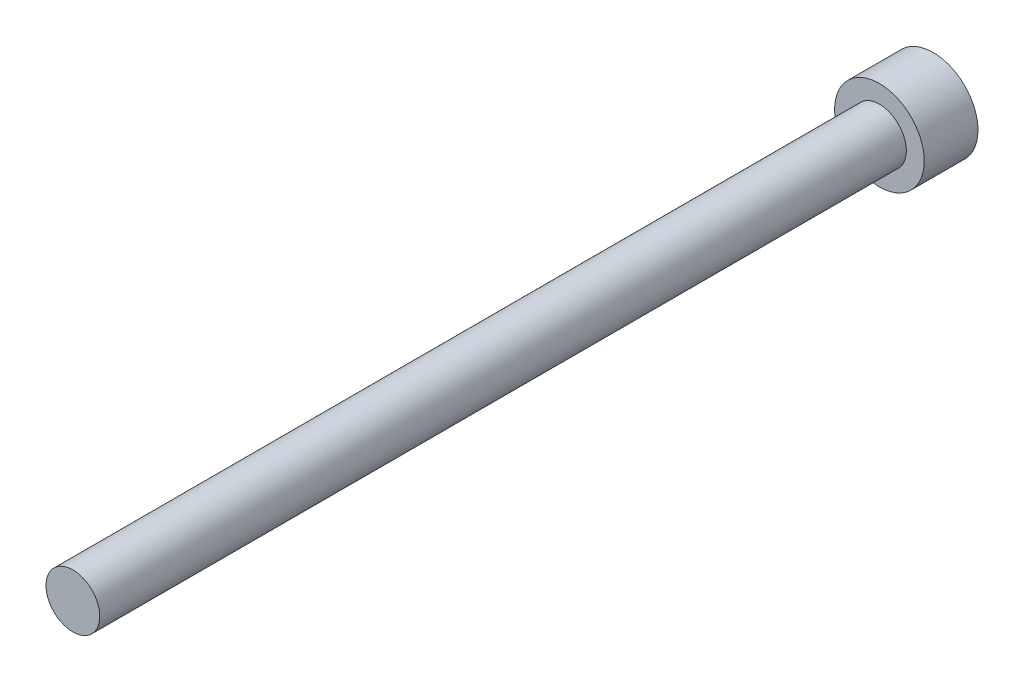
from build123d import *

# Parameters (mm, degrees)
HEAD_ENVELOPE_START         = -6
SKETCH1_R                   = 5
HEAD_ENVELOPE_DEPTH         = 6
SKETCH2_R                   = 3
THREAD_MAJOR_ENVELOPE_DEPTH = 90


with BuildPart() as part:
    # Sketch1 → Head_Envelope (new body)
    with BuildSketch(Plane.XY.offset(HEAD_ENVELOPE_START)):
        Circle(SKETCH1_R)
    extrude(amount=HEAD_ENVELOPE_DEPTH)

    # Sketch2 → Thread_Major_Envelope (add)
    with BuildSketch(Plane.XY):
        with Locations(Location((0, 0, 0), (0, 0, 180))):
            Circle(SKETCH2_R)
    extrude(amount=THREAD_MAJOR_ENVELOPE_DEPTH)


solid = part.part
